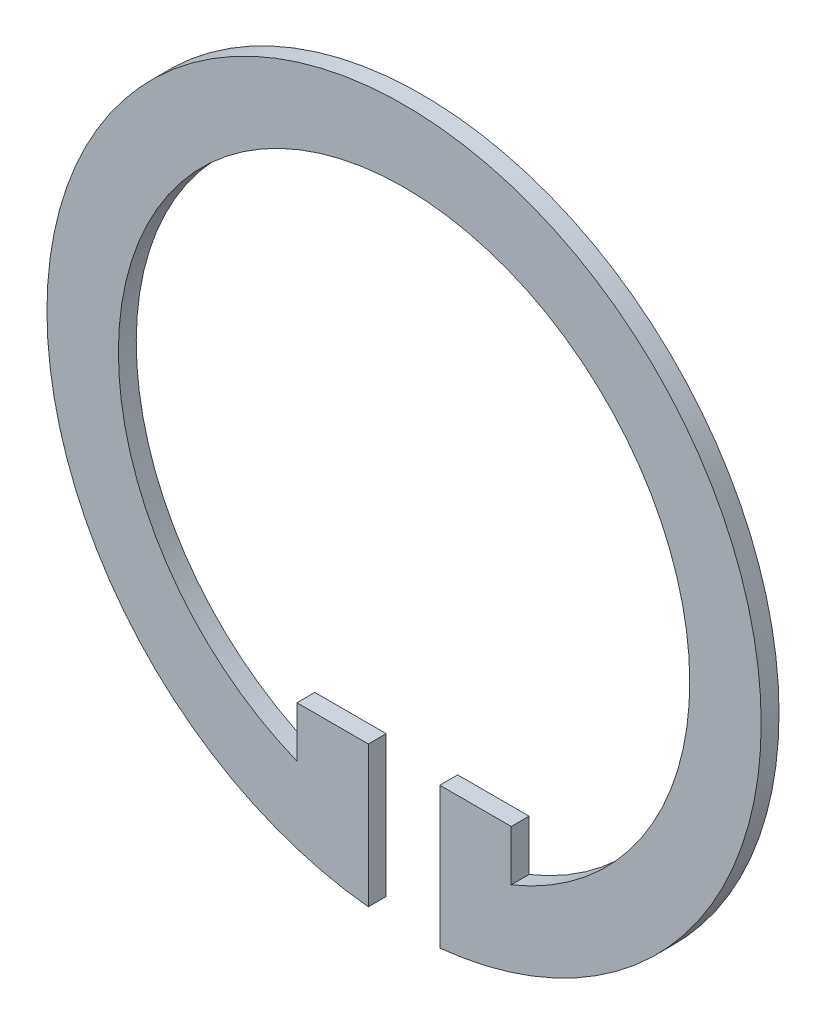
from build123d import *

# Parameters (mm, degrees)
EXTRUDE_1_DEPTH = 0.5


with BuildPart() as part:
    # 草图1 → 凸台-拉伸1 (new body)
    with BuildSketch(Plane.XY):
        with BuildLine():
            Line((-3, -6), (-1, -6))
            Line((-1, -6), (-1, -9.949874371))
            ThreePointArc((-1, -9.949874371), (0, 10), (1, -9.949874371))
            Line((1, -9.949874371), (1, -6))
            Line((1, -6), (3, -6))
            Line((3, -6), (3, -7.416198487))
            ThreePointArc((3, -7.416198487), (0, 8), (-3, -7.416198487))
            Line((-3, -7.416198487), (-3, -6))
        make_face()
    extrude(amount=EXTRUDE_1_DEPTH)


solid = part.part
